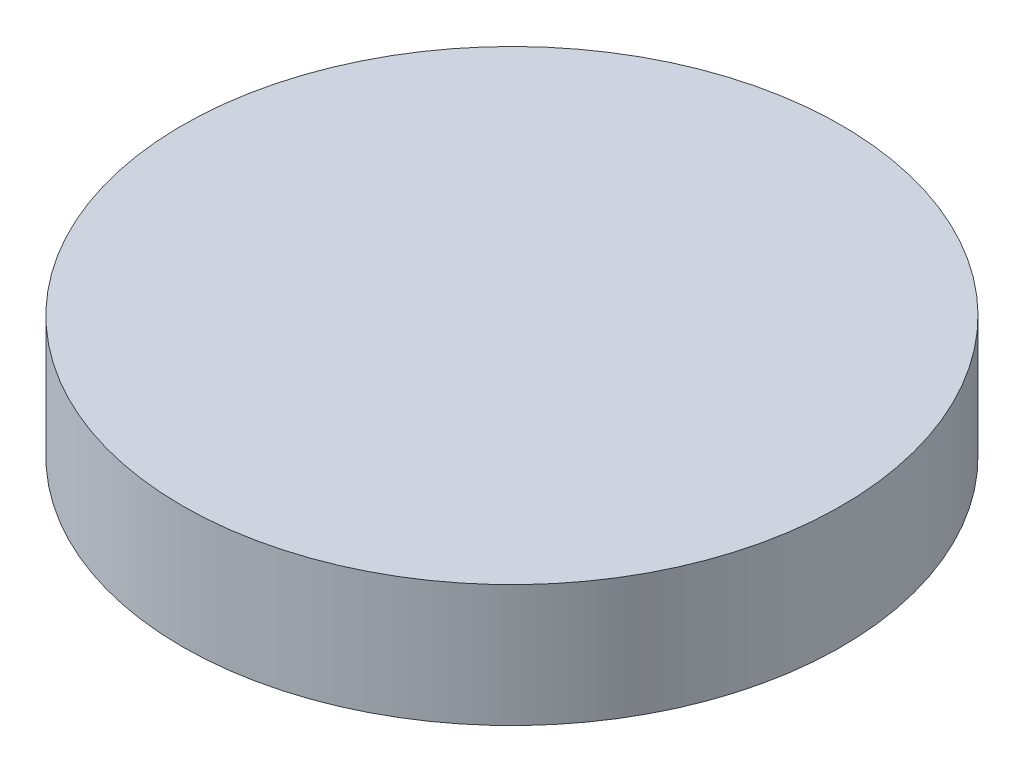
from build123d import *

# Parameters (mm, degrees)
SKETCH1_R           = 17.145
BOSS_EXTRUDE1_DEPTH = 6.35


with BuildPart() as part:
    # Sketch1 → Boss-Extrude1 (new body)
    with BuildSketch(Plane(origin=(0, 0, 0), x_dir=(1, 0, 0), z_dir=(0, 1, 0))):
        with Locations(Location((0, 0, 0), (0, 0, 270))):
            Circle(SKETCH1_R)
    extrude(amount=BOSS_EXTRUDE1_DEPTH)


solid = part.part
